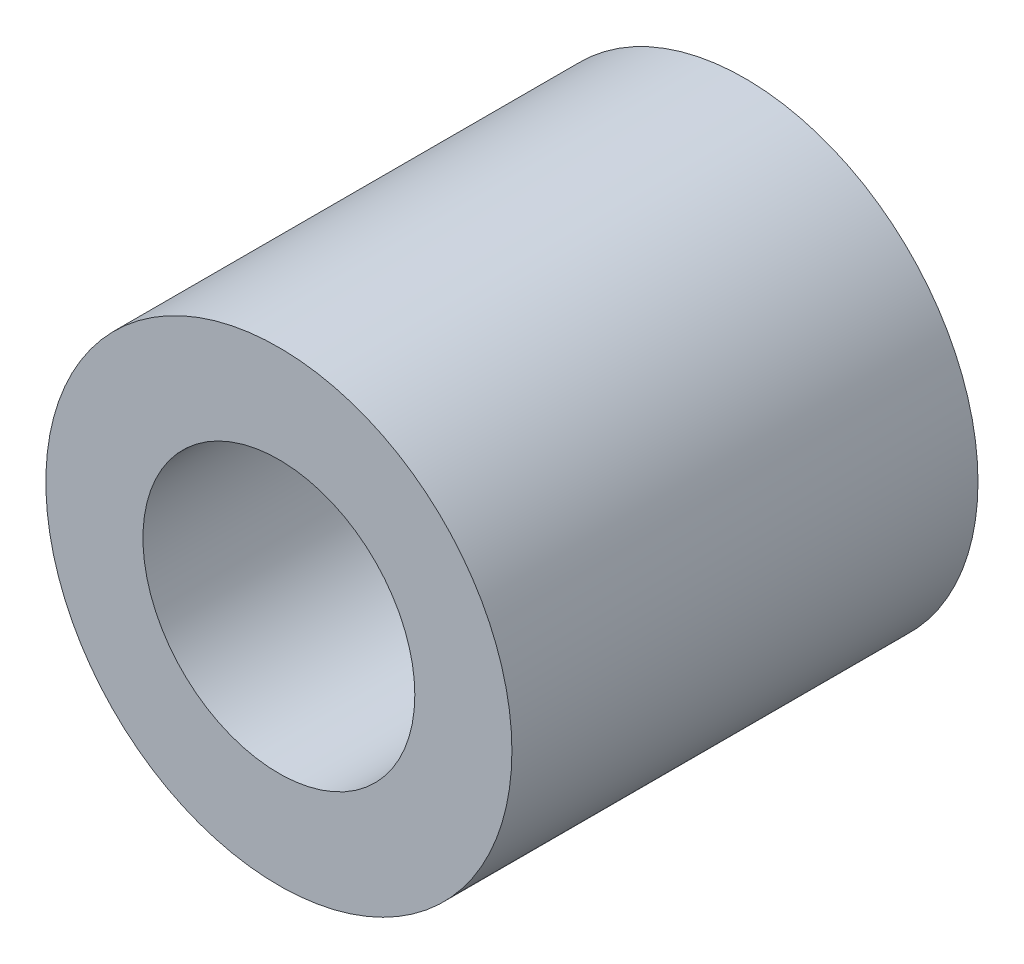
from build123d import *

# Parameters (mm, degrees)
SKETCH_1_R      = 6
SKETCH_1_R_2    = 3.5
EXTRUDE_1_DEPTH = 12


with BuildPart() as part:
    # 草图1 → 凸台-拉伸1 (new body)
    with BuildSketch(Plane.XY):
        Circle(SKETCH_1_R)
        Circle(SKETCH_1_R_2, mode=Mode.SUBTRACT)
    extrude(amount=EXTRUDE_1_DEPTH)


solid = part.part
